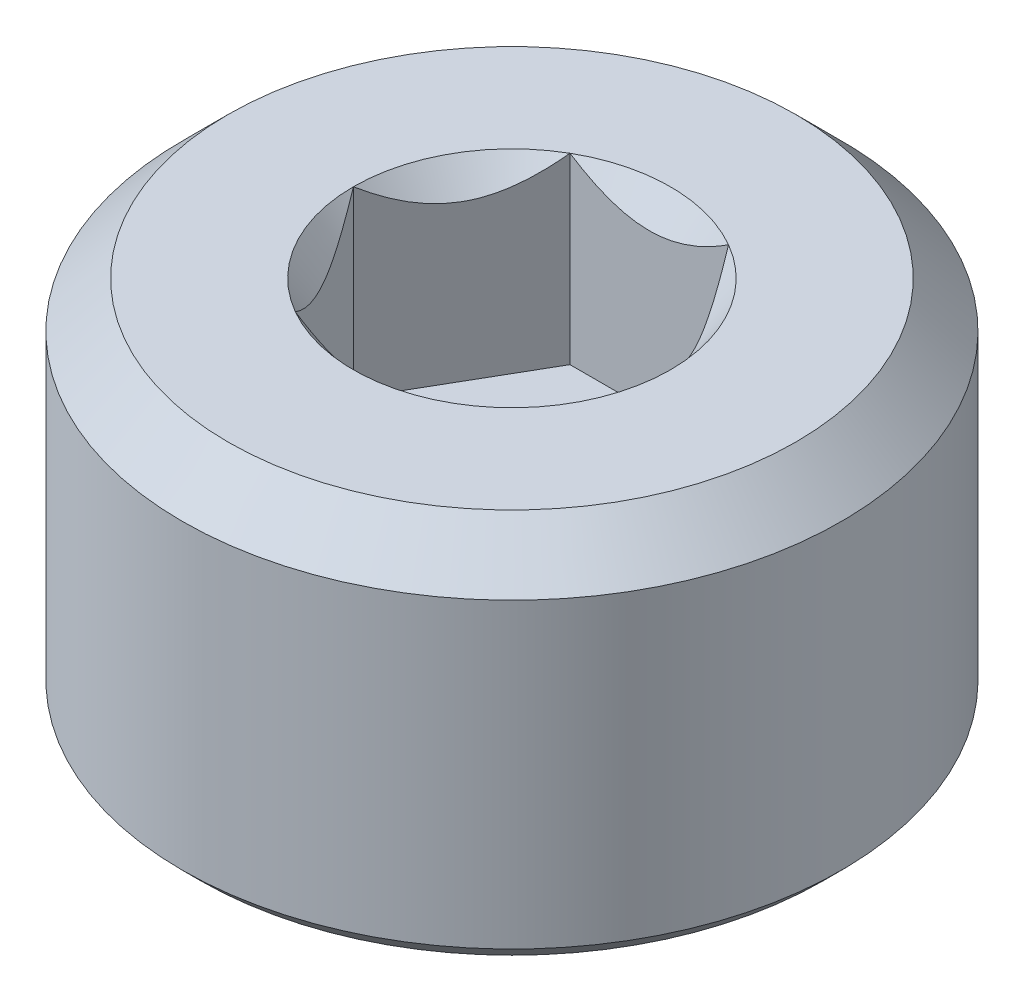
from build123d import *

# Parameters (mm, degrees)
SKETCH_1_R          = 3.6
EXTRUDE_1_DEPTH     = 4
CUT_EXTRUDE_1_DEPTH = 2
SKETCH_3_R          = 1.732050808
SKETCH_4_R          = 1.5
CHAMFER_1_SIZE      = 0.5
CHAMFER_2_SIZE      = 0.2


with BuildPart() as part:
    # 草图1 → 凸台-拉伸1 (new body)
    with BuildSketch(Plane(origin=(0, 0, 0), x_dir=(1, 0, 0), z_dir=(0, 1, 0))):
        with Locations(Location((0, 0, 0), (0, 0, 270))):
            Circle(SKETCH_1_R)
    extrude(amount=EXTRUDE_1_DEPTH)

    # 草图2 → 切除-拉伸1 (cut)
    with BuildSketch(Plane(origin=(0, 4, 0), x_dir=(1, 0, 0), z_dir=(0, 1, 0))):
        Polygon((1.732050808, 0), (0.866025404, 1.5), (-0.866025404, 1.5), (-1.732050808, 0), (-0.866025404, -1.5), (0.866025404, -1.5), align=None)
    extrude(amount=-CUT_EXTRUDE_1_DEPTH, mode=Mode.SUBTRACT)

    # 草图3 → 切除-放样1 section 0
    with BuildSketch(Plane(origin=(0, 4, 0), x_dir=(1, 0, 0), z_dir=(0, 1, 0))):
        Circle(SKETCH_3_R)
    # 草图4 → 切除-放样1 section 1
    with BuildSketch(Plane(origin=(0, 3.7, 0), x_dir=(1, 0, 0), z_dir=(0, 1, 0))):
        Circle(SKETCH_4_R)
    loft(mode=Mode.SUBTRACT)

    # 倒角1
    chamfer_1_edges = [part.edges().sort_by_distance(p)[0] for p in [
        (0, 4, -3.6),
    ]]
    chamfer(chamfer_1_edges, length=CHAMFER_1_SIZE)

    # 倒角2
    chamfer_2_edges = [part.edges().sort_by_distance(p)[0] for p in [
        (0, 0, -3.6),
    ]]
    chamfer(chamfer_2_edges, length=CHAMFER_2_SIZE)


solid = part.part
